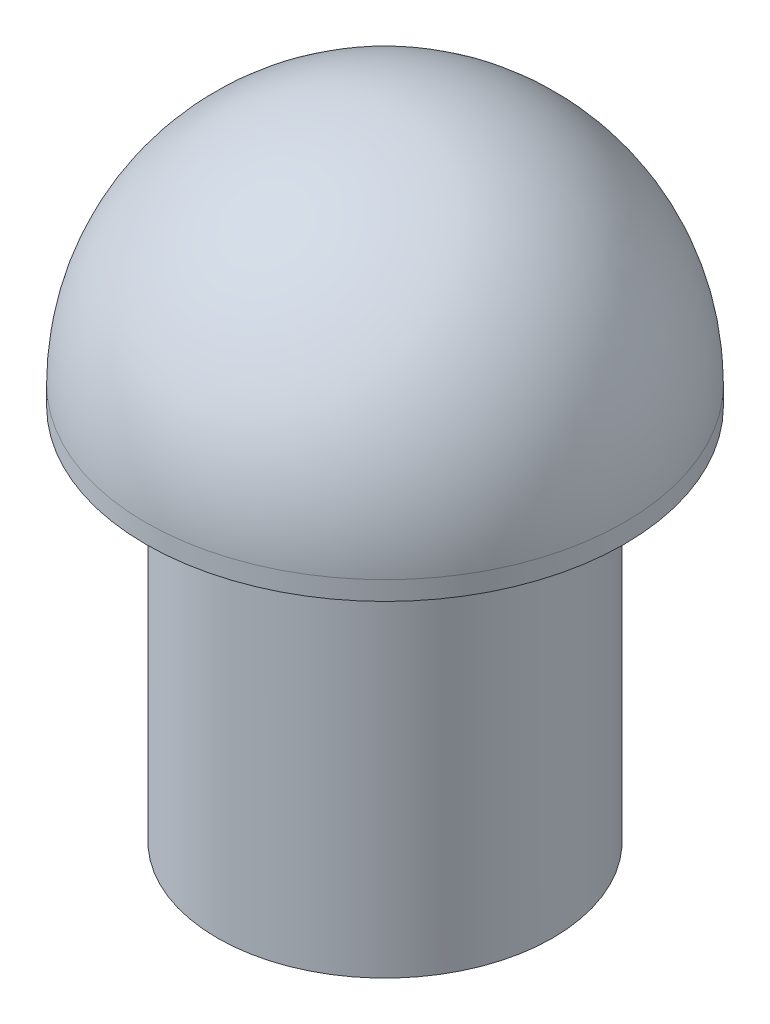
from build123d import *

# Parameters (mm, degrees)
SKETCH1_R           = 6.35
BOSS_EXTRUDE1_DEPTH = 0.5
DOME1_FACE_RADIUS   = 6.35
DOME1_HEIGHT        = 6.35
SKETCH2_R           = 4.45
SKETCH2_R_2         = 3
BOSS_EXTRUDE2_DEPTH = 10


with BuildPart() as part:
    # Sketch1 → Boss-Extrude1 (new body)
    with BuildSketch(Plane(origin=(0, 0, 0), x_dir=(1, 0, 0), z_dir=(0, 1, 0))):
        with Locations(Location((0, 0, 0), (0, 0, 270))):
            Circle(SKETCH1_R)
    extrude(amount=BOSS_EXTRUDE1_DEPTH)

    # Dome1: a dome of height H over a round flat face of radius A is a cap of a sphere of radius (A * A + H * H) / (2 * H)
    dome1_r = (DOME1_FACE_RADIUS * DOME1_FACE_RADIUS + DOME1_HEIGHT * DOME1_HEIGHT) / (2 * DOME1_HEIGHT)
    dome1_base = Plane((0, 0.5, 0), z_dir=(0, 1, 0))
    with Locations(dome1_base.offset(DOME1_HEIGHT - dome1_r)):
        dome1_ball = Sphere(dome1_r, mode=Mode.PRIVATE)
    add(split(dome1_ball, bisect_by=dome1_base, keep=Keep.TOP, mode=Mode.PRIVATE))

    # Sketch2 → Boss-Extrude2 (add)
    with BuildSketch(Plane.XZ):
        with Locations(Location((0, 0, 0), (0, 0, 90))):
            Circle(SKETCH2_R)
        with Locations(Location((0, 0, 0), (0, 0, 270))):
            Circle(SKETCH2_R_2, mode=Mode.SUBTRACT)
    extrude(amount=BOSS_EXTRUDE2_DEPTH)


solid = part.part
